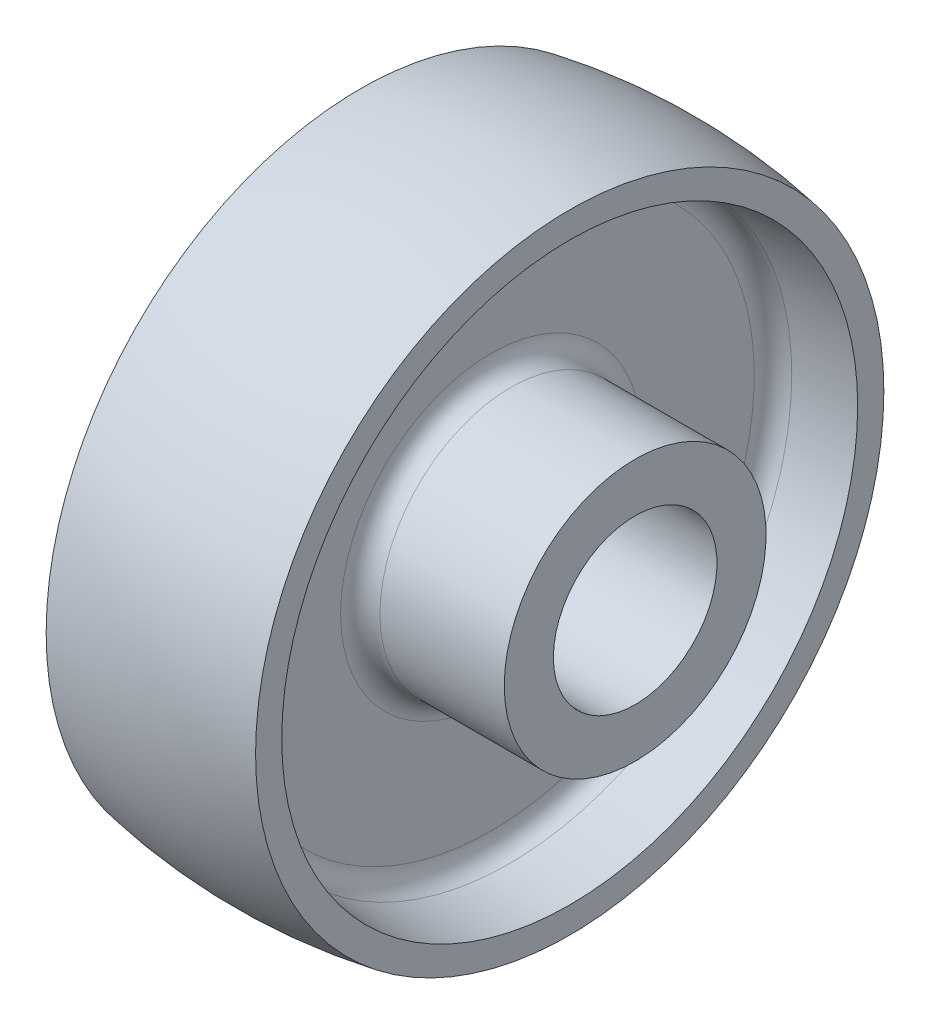
from build123d import *

# Parameters (mm, degrees)
RACCORDO4_R = 3


with BuildPart() as part:
    # Schizzo2 → Rivoluzione1 (revolve)
    with BuildSketch(Plane.XY, mode=Mode.PRIVATE) as rivoluzione1_sk:
        with BuildLine():
            Line((26, 12.5), (-26, 12.5))
            Line((-26, 12.5), (-26, 20))
            Line((-26, 20), (-4, 20))
            Line((-4, 20), (-4, 42.950136038))
            Line((-4, 42.950136038), (-16, 44))
            Line((-16, 44), (-16, 48))
            ThreePointArc((-16, 48), (0, 49.433640698), (16, 48))
            Line((16, 48), (16, 44))
            Line((16, 44), (4, 42.950136038))
            Line((4, 42.950136038), (4, 20))
            Line((4, 20), (26, 20))
            Line((26, 20), (26, 12.5))
        make_face()
    revolve(rivoluzione1_sk.sketch.rotate(Axis((0, 0, 0), (1, 0, 0)), 90), axis=Axis((0, 0, 0), (1, 0, 0)))

    # Raccordo4
    raccordo4_edges = [part.edges().sort_by_distance(p)[0] for p in [
        (4, 0, -42.950136038),
        (-4, 0, -42.950136038),
        (-4, 0, -20),
        (4, 0, -20),
    ]]
    fillet(raccordo4_edges, radius=RACCORDO4_R)


solid = part.part
